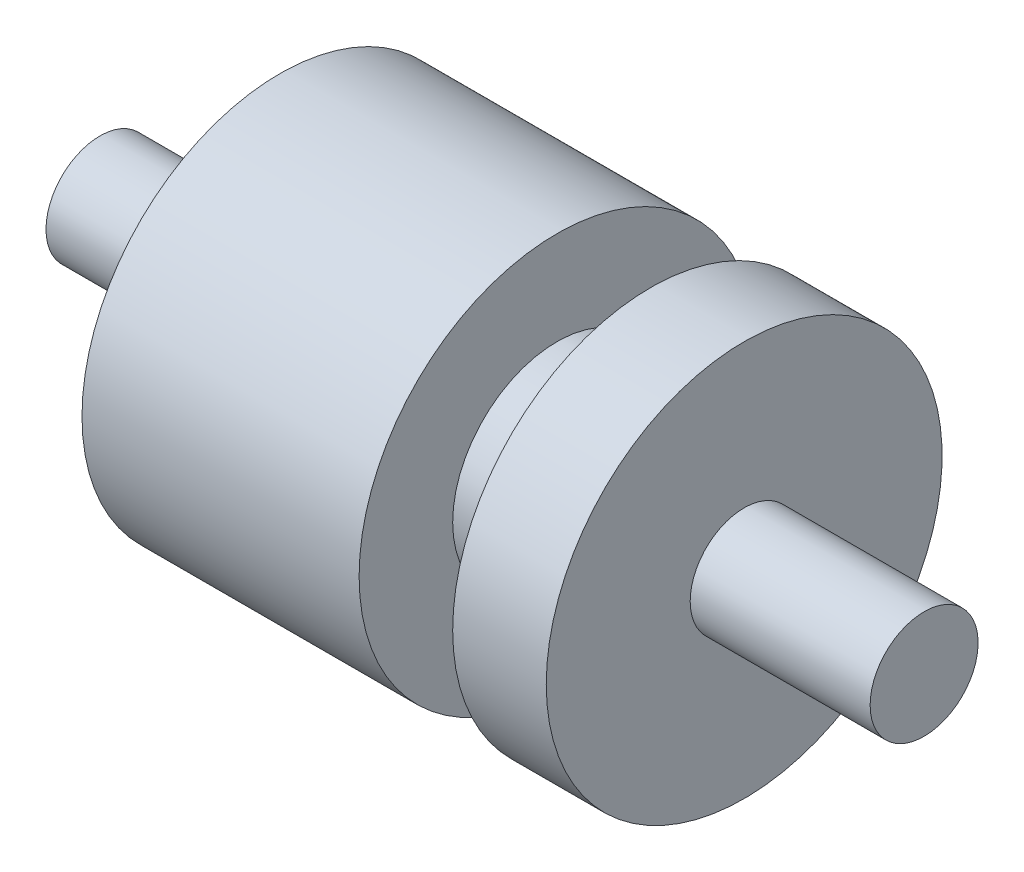
from build123d import *


with BuildPart() as part:
    # Croquis2 → Revolución1 (revolve)
    with BuildSketch(Plane.XY, mode=Mode.PRIVATE) as revoluci_n1_sk:
        Polygon((-22.9, 1.5), (-17.9, 1.5), (-17.9, 5.5), (-10.2, 5.5), (-10.2, 2.9), (-7.6, 2.9), (-7.6, 5.5), (-5, 5.5), (-5, 1.5), (0, 1.5), (0, 0), (-22.9, 0), align=None)
    revolve(revoluci_n1_sk.sketch.rotate(Axis((-68.094328552, 0, 0), (1, 0, 0)), 90), axis=Axis((-68.094328552, 0, 0), (1, 0, 0)))


solid = part.part
